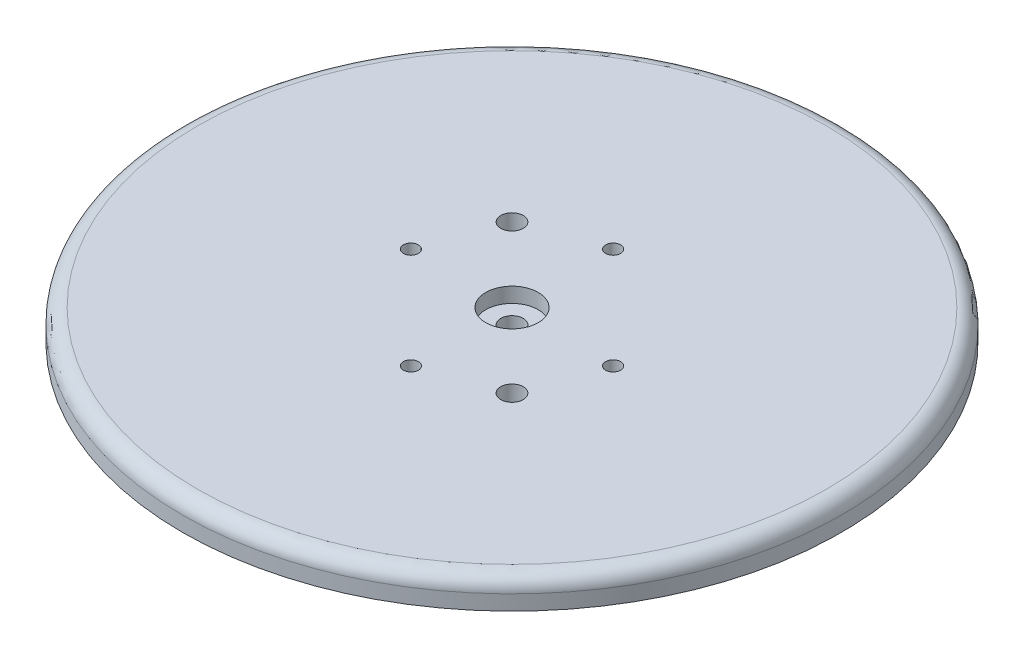
from build123d import *

# Parameters (mm, degrees)
SKETCH1_R           = 44
BOSS_EXTRUDE1_DEPTH = 4
SKETCH2_R           = 3.5
CUT_EXTRUDE1_DEPTH  = 2
SKETCH3_R           = 1
CUT_EXTRUDE2_DEPTH  = 63.353829072
SKETCH5_R           = 1.5
CUT_EXTRUDE3_DEPTH  = 63.257529665
SKETCH6_R           = 1.5
CUT_EXTRUDE4_DEPTH  = 63.353829072
FILLET1_R           = 2


with BuildPart() as part:
    # Sketch1 → Boss-Extrude1 (new body)
    with BuildSketch(Plane(origin=(0, 0, 0), x_dir=(1, 0, 0), z_dir=(0, 1, 0))):
        with Locations(Location((0, 0, 0), (0, 0, 270))):
            Circle(SKETCH1_R)
    extrude(amount=BOSS_EXTRUDE1_DEPTH)

    # Sketch2 → Cut-Extrude1 (cut)
    with BuildSketch(Plane(origin=(0, 4, 0), x_dir=(1, 0, 0), z_dir=(0, 1, 0))):
        with Locations(Location((0, 0, 0), (0, 0, 270))):
            Circle(SKETCH2_R)
    extrude(amount=-CUT_EXTRUDE1_DEPTH, mode=Mode.SUBTRACT)

    # Sketch3 → Cut-Extrude2 (cut, through all)
    with BuildSketch(Plane(origin=(0, 4, 0), x_dir=(1, 0, 0), z_dir=(0, 1, 0))):
        with Locations(Location((0, 13.5, 0), (0, 0, 270))):
            Circle(SKETCH3_R)
        with Locations(Location((0, -13.5, 0), (0, 0, 90))):
            Circle(SKETCH3_R)
        with Locations(Location((-13.5, 0, 0), (0, 0, 270))):
            Circle(SKETCH3_R)
        with Locations(Location((13.5, 0, 0), (0, 0, 90))):
            Circle(SKETCH3_R)
    extrude(amount=-CUT_EXTRUDE2_DEPTH, mode=Mode.SUBTRACT)

    # Sketch5 → Cut-Extrude3 (cut, through all)
    with BuildSketch(Plane(origin=(0, 2, 0), x_dir=(1, 0, 0), z_dir=(0, 1, 0))):
        with Locations(Location((0, 0, 0), (0, 0, 270))):
            Circle(SKETCH5_R)
    extrude(amount=-CUT_EXTRUDE3_DEPTH, mode=Mode.SUBTRACT)

    # Sketch6 → Cut-Extrude4 (cut, through all)
    with BuildSketch(Plane(origin=(0, 4, 0), x_dir=(1, 0, 0), z_dir=(0, 1, 0))):
        with Locations(Location((-9.899494937, 9.899494937, 0), (0, 0, 270))):
            Circle(SKETCH6_R)
        with Locations(Location((9.899494937, -9.899494937, 0), (0, 0, 90))):
            Circle(SKETCH6_R)
    extrude(amount=-CUT_EXTRUDE4_DEPTH, mode=Mode.SUBTRACT)

    # Fillet1
    fillet1_edges = [part.edges().sort_by_distance(p)[0] for p in [
        (0, 4, -44),
    ]]
    fillet(fillet1_edges, radius=FILLET1_R)


solid = part.part
